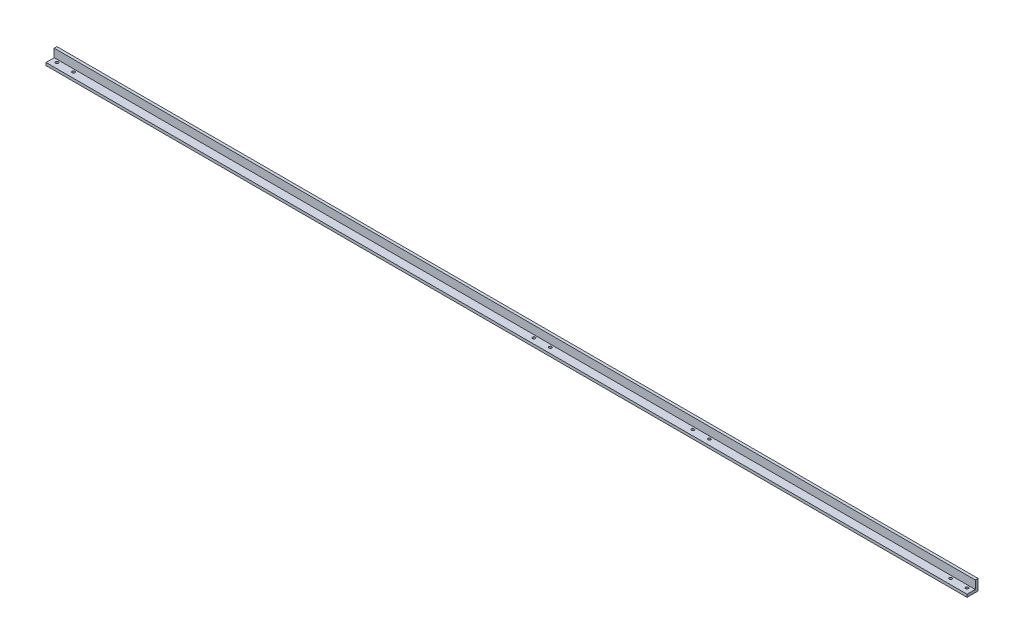
from build123d import *

# Parameters (mm, degrees)
BOSS_EXTRUDE1_DEPTH = 2133.6
SKETCH2_R           = 3.175
CUT_EXTRUDE1_DEPTH  = 914.4


with BuildPart() as part:
    # Sketch1 → Boss-Extrude1 (new body)
    with BuildSketch(Plane(origin=(0, 0, 0), x_dir=(0, 0, -1), z_dir=(1, 0, 0))):
        Polygon((0, 0), (0, 19.05), (6.35, 19.05), (6.35, -6.35), (-19.05, -6.35), (-19.05, 0), align=None)
    extrude(amount=BOSS_EXTRUDE1_DEPTH)

    # Sketch2 → Cut-Extrude1 (cut)
    with BuildSketch(Plane.XZ.offset(6.35)):
        with Locations(Location((12.7, 6.35, 0), (0, 0, 270))):
            Circle(SKETCH2_R)
        with Locations(Location((50.8, 6.35, 0), (0, 0, 270))):
            Circle(SKETCH2_R)
        with Locations(Location((1117.6, 6.35, 0), (0, 0, 270))):
            Circle(SKETCH2_R)
        with Locations(Location((1155.7, 6.35, 0), (0, 0, 270))):
            Circle(SKETCH2_R)
        with Locations(Location((1485.9, 6.35, 0), (0, 0, 270))):
            Circle(SKETCH2_R)
        with Locations(Location((1524, 6.35, 0), (0, 0, 270))):
            Circle(SKETCH2_R)
        with Locations(Location((2082.8, 6.35, 0), (0, 0, 270))):
            Circle(SKETCH2_R)
        with Locations(Location((2120.9, 6.35, 0), (0, 0, 270))):
            Circle(SKETCH2_R)
    extrude(amount=-CUT_EXTRUDE1_DEPTH, mode=Mode.SUBTRACT)


solid = part.part
